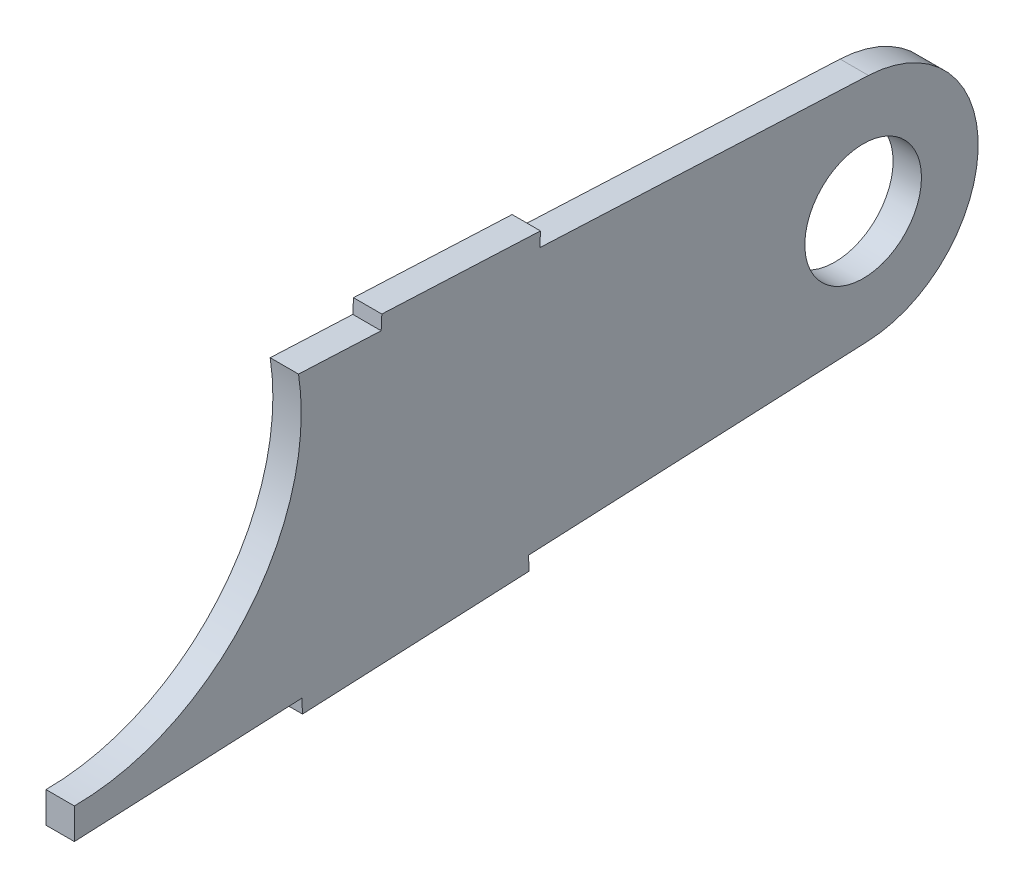
from build123d import *

# Parameters (mm, degrees)
SKETCH1_R           = 3.2639
BOSS_EXTRUDE1_DEPTH = 0.79375


with BuildPart() as part:
    # Sketch1 → Boss-Extrude1 (new, symmetric)
    with BuildSketch(Plane(origin=(0, 0, 0), x_dir=(0, 0, -1), z_dir=(1, 0, 0))):
        with BuildLine():
            Line((-44.152950291, -6.755130934), (-44.152950291, -8.484869066))
            Line((-44.152950291, -8.484869066), (-31.419145372, -7.896786517))
            Line((-31.419145372, -7.896786517), (-31.382526818, -8.689691394))
            Line((-31.382526818, -8.689691394), (-18.696048786, -8.103794532))
            Line((-18.696048786, -8.103794532), (-18.73266734, -7.310889655))
            Line((-18.73266734, -7.310889655), (0.297049709, -6.432044362))
            ThreePointArc((0.297049709, -6.432044362), (6.4389, 0), (0.297049709, 6.432044362))
            Line((0.297049709, 6.432044362), (-18.098343438, 7.281594812))
            Line((-18.098343438, 7.281594812), (-18.061724884, 8.074499689))
            Line((-18.061724884, 8.074499689), (-26.942259507, 8.484627492))
            Line((-26.942259507, 8.484627492), (-26.978878061, 7.691722615))
            Line((-26.978878061, 7.691722615), (-31.605185419, 7.905378364))
            ThreePointArc((-31.605185419, 7.905378364), (-34.50441496, -2.313203709), (-44.152950291, -6.755130934))
        make_face()
        Circle(SKETCH1_R, mode=Mode.SUBTRACT)
    extrude(amount=BOSS_EXTRUDE1_DEPTH, both=True)


solid = part.part
